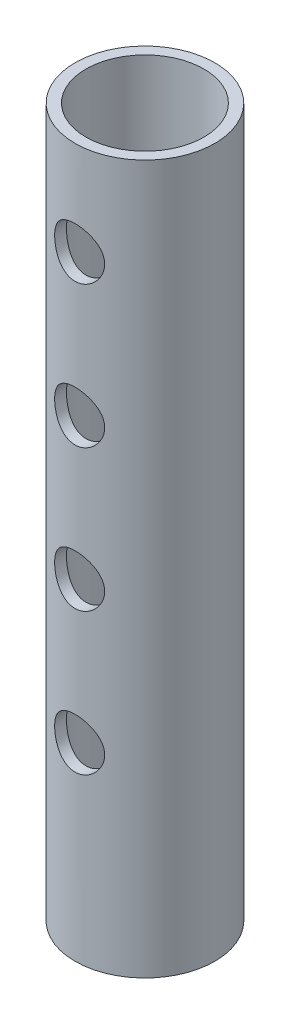
from build123d import *

# Parameters (mm, degrees)
SKETCH_1_R               = 7.4
SKETCH_1_R_2             = 6.25
EXTRUDE_1_DEPTH          = 75
CUT_EXTRUDE_1_DEPTH      = 76.726613552
CUT_EXTRUDE_1_DEPTH_BACK = 76.726613552
SKETCH_3_R               = 2.65


with BuildPart() as part:
    # 草图1 → 凸台-拉伸1 (new body)
    with BuildSketch(Plane(origin=(0, 0, 0), x_dir=(1, 0, 0), z_dir=(0, 1, 0))):
        with Locations(Location((0, 0, 0), (0, 0, 270))):
            Circle(SKETCH_1_R)
        with Locations(Location((0, 0, 0), (0, 0, 270))):
            Circle(SKETCH_1_R_2, mode=Mode.SUBTRACT)
    extrude(amount=EXTRUDE_1_DEPTH)

    # 草图3 → 切除-拉伸1 (cut, two sides: drawn at the far end of the back side and taken through both)
    with BuildSketch(Plane.XY.offset(-CUT_EXTRUDE_1_DEPTH_BACK)):
        with Locations((0, 20)):
            Circle(SKETCH_3_R)
        with Locations((0, 35)):
            Circle(SKETCH_3_R)
        with Locations((0, 50)):
            Circle(SKETCH_3_R)
        with Locations((0, 65)):
            Circle(SKETCH_3_R)
    extrude(amount=CUT_EXTRUDE_1_DEPTH + CUT_EXTRUDE_1_DEPTH_BACK, mode=Mode.SUBTRACT)


solid = part.part
